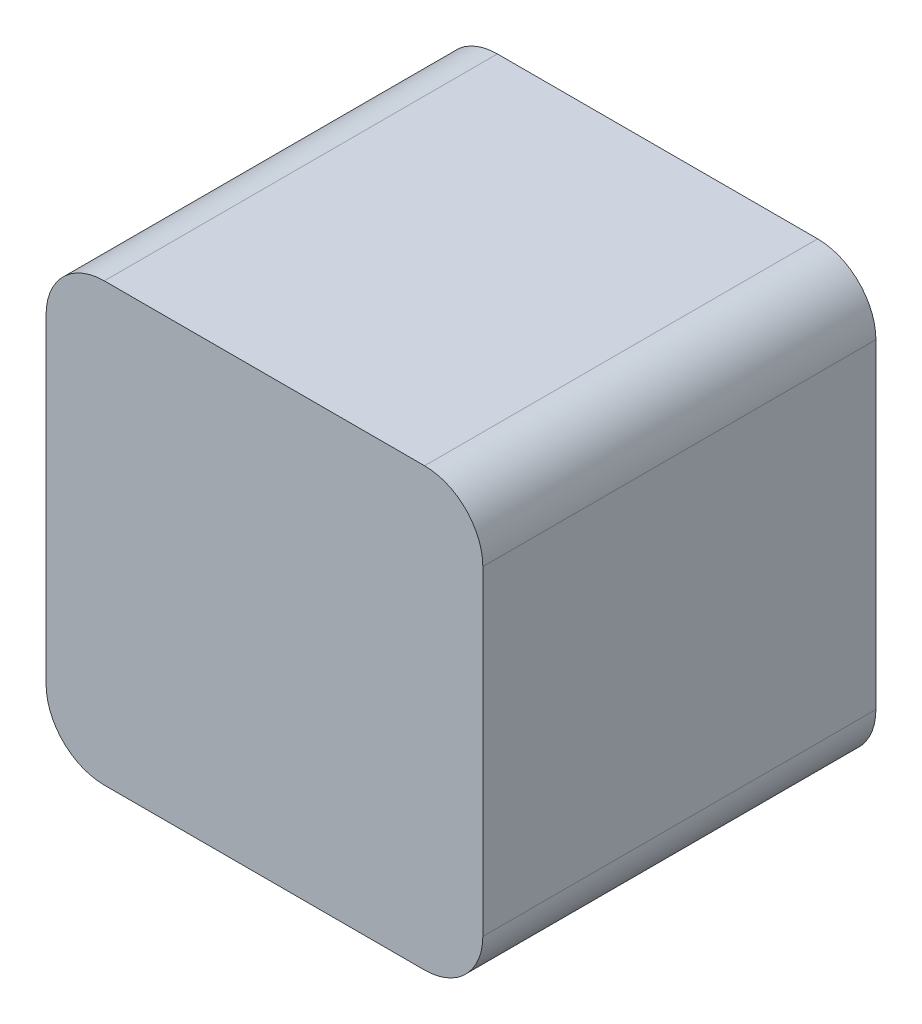
from build123d import *

# Parameters (mm, degrees)
SKETCH1_W           = 15
SKETCH1_H           = 15
BOSS_EXTRUDE1_DEPTH = 11
FILLET1_R           = 2
BOSS_EXTRUDE2_DEPTH = 2.5


with BuildPart() as part:
    # Sketch1 → Boss-Extrude1 (new body)
    with BuildSketch(Plane.XY):
        Rectangle(SKETCH1_W, SKETCH1_H)
        with BuildLine():
            Line((-1.658312395, 2.5), (1.658312395, 2.5))
            ThreePointArc((1.658312395, 2.5), (0, -3), (-1.658312395, 2.5))
        make_face(mode=Mode.SUBTRACT)
    extrude(amount=-BOSS_EXTRUDE1_DEPTH)

    # Fillet1
    fillet1_edges = [part.edges().sort_by_distance(p)[0] for p in [
        (7.5, -7.5, -5.5),
        (-7.5, -7.5, -5.5),
        (-7.5, 7.5, -5.5),
        (7.5, 7.5, -5.5),
    ]]
    fillet(fillet1_edges, radius=FILLET1_R)

    # Sketch2 → Boss-Extrude2 (add)
    with BuildSketch(Plane.XY):
        with BuildLine():
            Line((7.5, -5.5), (7.5, 5.5))
            ThreePointArc((7.5, 5.5), (6.914213562, 6.914213562), (5.5, 7.5))
            Line((5.5, 7.5), (-5.5, 7.5))
            ThreePointArc((-5.5, 7.5), (-6.914213562, 6.914213562), (-7.5, 5.5))
            Line((-7.5, 5.5), (-7.5, -5.5))
            ThreePointArc((-7.5, -5.5), (-6.914213562, -6.914213562), (-5.5, -7.5))
            Line((-5.5, -7.5), (5.5, -7.5))
            ThreePointArc((5.5, -7.5), (6.914213562, -6.914213562), (7.5, -5.5))
        make_face()
    extrude(amount=BOSS_EXTRUDE2_DEPTH)


solid = part.part
